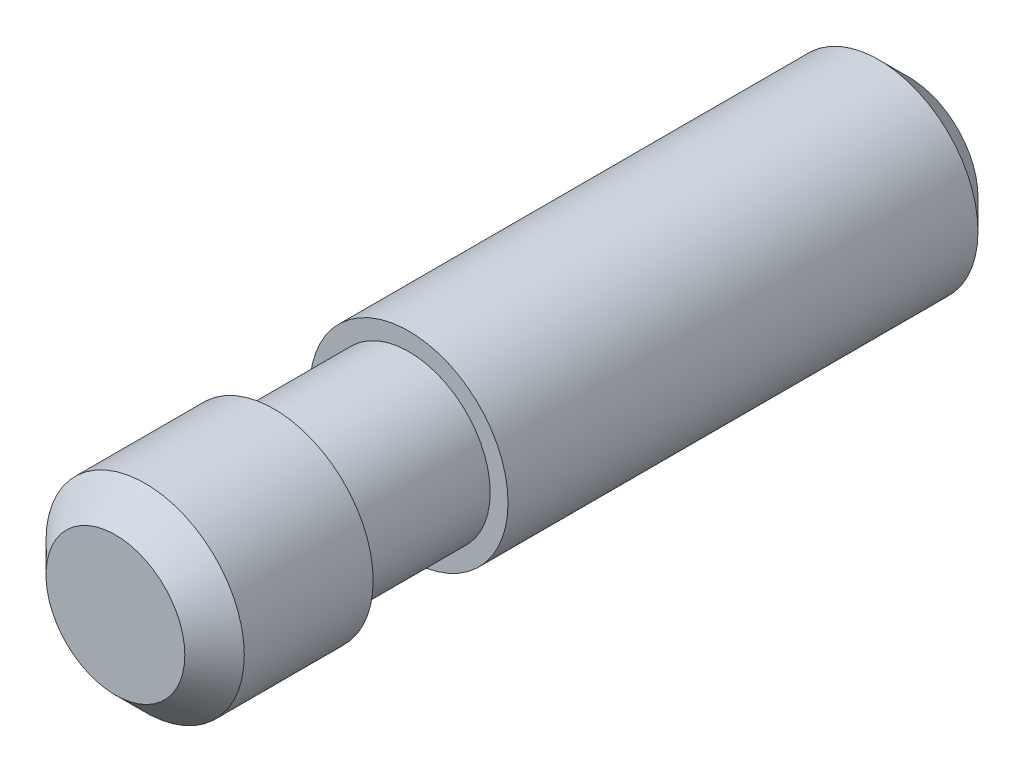
from build123d import *

# Parameters (mm, degrees)
SKETCH_1_R      = 2.5
EXTRUDE_1_DEPTH = 20
CHAMFER_1_SIZE  = 0.75
SKETCH_2_W      = 3.4
SKETCH_2_H      = 0.45


with BuildPart() as part:
    # Эскиз1 → Бобышка-Вытянуть1 (new body)
    with BuildSketch(Plane.XY):
        Circle(SKETCH_1_R)
    extrude(amount=EXTRUDE_1_DEPTH)

    # Фаска1
    chamfer_1_edges = [part.edges().sort_by_distance(p)[0] for p in [
        (-2.5, 0, 20),
        (-2.5, 0, 0),
    ]]
    chamfer(chamfer_1_edges, length=CHAMFER_1_SIZE)

    # Эскиз2 → Вырез-Повернуть1 (revolve, cut)
    with BuildSketch(Plane(origin=(0, 0, 0), x_dir=(0, 0, -1), z_dir=(1, 0, 0))):
        with Locations((-14.3, 2.275)):
            Rectangle(SKETCH_2_W, SKETCH_2_H)
    revolve(axis=Axis((0, 0, 20), (0, 0, -1)), mode=Mode.SUBTRACT)


solid = part.part
